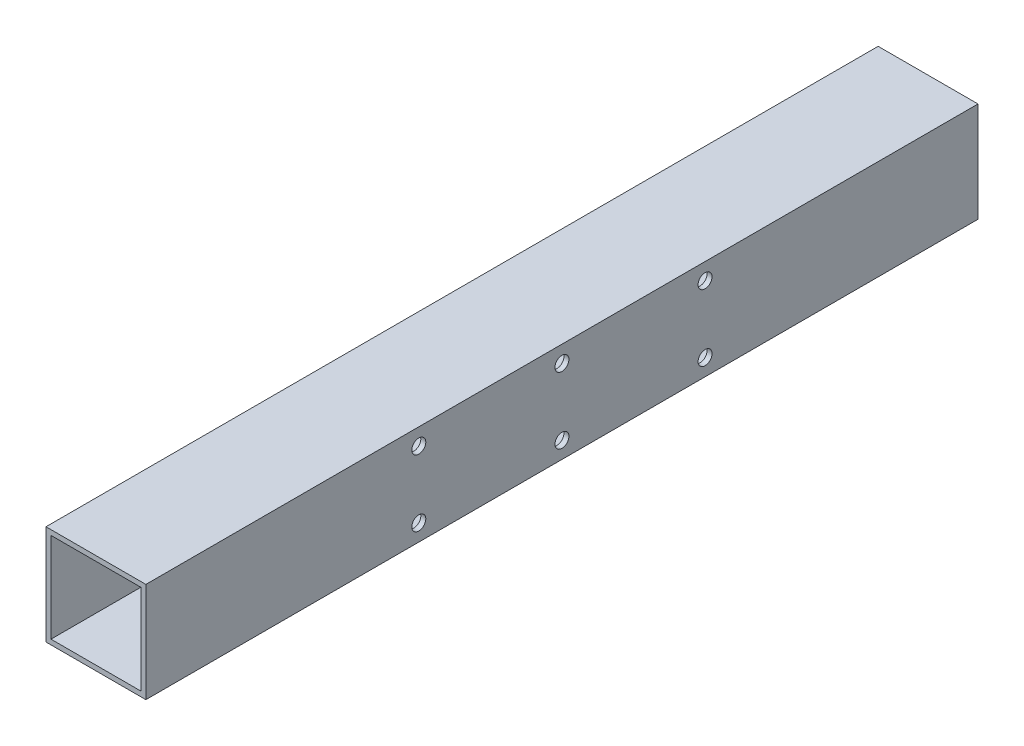
from build123d import *

# Parameters (mm, degrees)
SKETCH1_W           = 30
SKETCH1_H           = 30
SKETCH1_W_2         = 27
SKETCH1_H_2         = 27
BOSS_EXTRUDE1_DEPTH = 250
SKETCH2_R           = 2.1
CUT_EXTRUDE1_DEPTH  = 254.574446662


with BuildPart() as part:
    # Sketch1 → Boss-Extrude1 (new body)
    with BuildSketch(Plane.XY):
        with Locations((15, 15)):
            Rectangle(SKETCH1_W, SKETCH1_H)
        with Locations((15, 15)):
            Rectangle(SKETCH1_W_2, SKETCH1_H_2, mode=Mode.SUBTRACT)
    extrude(amount=BOSS_EXTRUDE1_DEPTH)

    # Sketch2 → Cut-Extrude1 (cut, through all)
    with BuildSketch(Plane.ZY):
        with Locations((125, 25)):
            Circle(SKETCH2_R)
        with Locations((125, 5)):
            Circle(SKETCH2_R)
        with Locations((168, 25)):
            Circle(SKETCH2_R)
        with Locations((168, 5)):
            Circle(SKETCH2_R)
        with Locations((82, 5)):
            Circle(SKETCH2_R)
        with Locations((82, 25)):
            Circle(SKETCH2_R)
    extrude(amount=-CUT_EXTRUDE1_DEPTH, mode=Mode.SUBTRACT)


solid = part.part
